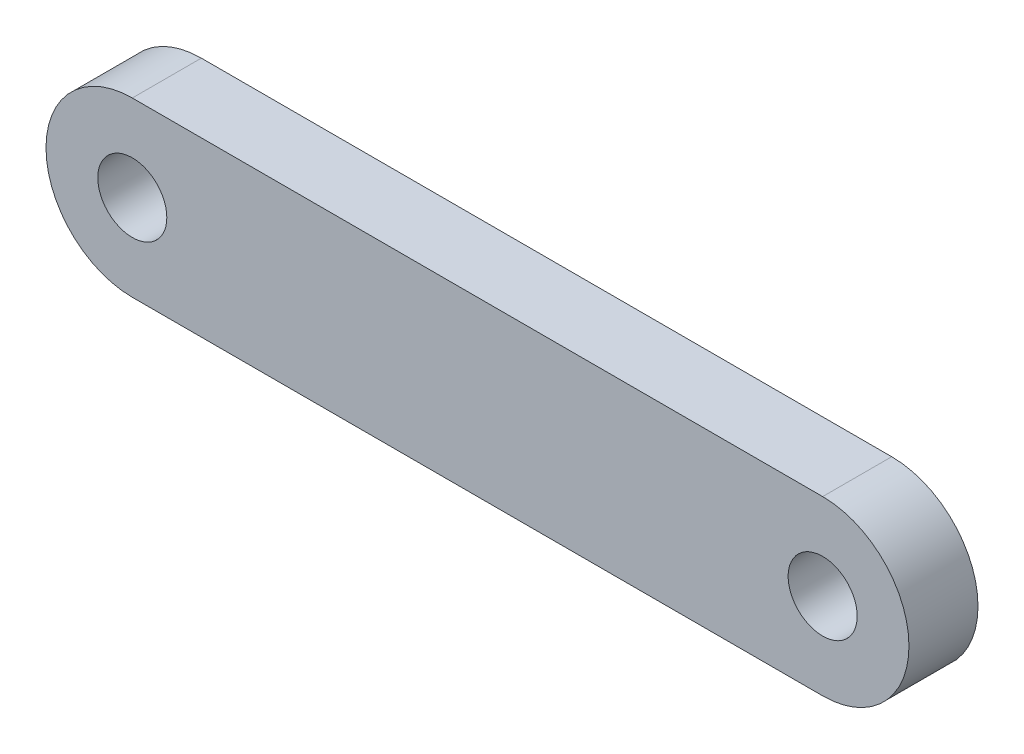
from build123d import *

# Parameters (mm, degrees)
ESQUISSE1_R        = 2
BOSS_EXTRU_1_DEPTH = 4


with BuildPart() as part:
    # Esquisse1 → Boss.-Extru.1 (new body)
    with BuildSketch(Plane.XY):
        with BuildLine():
            Line((0, 5), (40, 5))
            ThreePointArc((40, 5), (45, 0), (40, -5))
            Line((40, -5), (0, -5))
            ThreePointArc((0, -5), (-5, 0), (0, 5))
        make_face()
        with Locations((40, 0)):
            Circle(ESQUISSE1_R, mode=Mode.SUBTRACT)
        Circle(ESQUISSE1_R, mode=Mode.SUBTRACT)
    extrude(amount=BOSS_EXTRU_1_DEPTH)


solid = part.part
